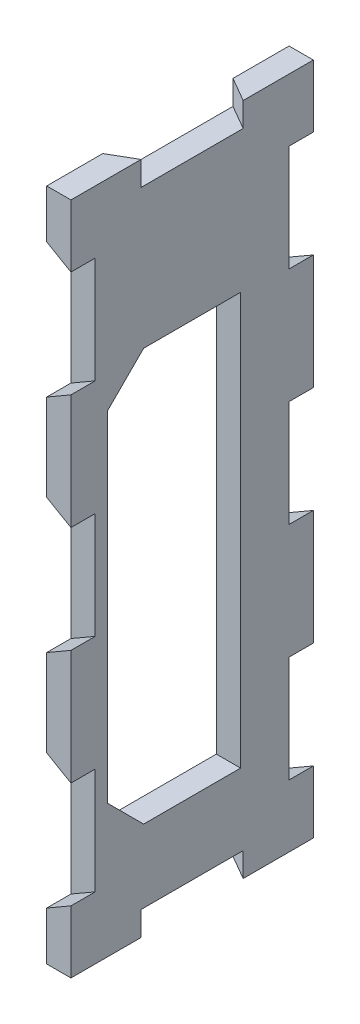
from build123d import *

# Parameters (mm, degrees)
SKETCH2_W           = 139
SKETCH2_H           = 50
BOSS_EXTRUDE1_DEPTH = 5
CUT_EXTRUDE1_DEPTH  = 5
CUT_EXTRUDE2_START  = -45
CUT_EXTRUDE2_DEPTH  = 5
CUT_EXTRUDE3_DEPTH  = 5
CUT_EXTRUDE5_START  = -134
CUT_EXTRUDE5_DEPTH  = 5
CUT_EXTRUDE6_DEPTH  = 5


with BuildPart() as part:
    # Sketch2 → Boss-Extrude1 (new body)
    with BuildSketch(Plane.YZ):
        Rectangle(SKETCH2_W, SKETCH2_H)
    extrude(amount=BOSS_EXTRUDE1_DEPTH)

    # Sketch3 → Cut-Extrude1 (cut)
    with BuildSketch(Plane(origin=(0, 0, -25), x_dir=(1, 0, 0), z_dir=(0, 0, -1))):
        Polygon((0, 31.787187079), (0, 59.5), (24, 45.643593539), align=None)
        Polygon((0, -13.856406461), (0, 13.856406461), (24, 0), align=None)
        Polygon((0, -59.5), (0, -31.787187079), (24, -45.643593539), align=None)
    extrude(amount=-CUT_EXTRUDE1_DEPTH, mode=Mode.SUBTRACT)

    # Sketch3<3> → Cut-Extrude2 (cut)
    with BuildSketch(Plane(origin=(0, 0, -25), x_dir=(1, 0, 0), z_dir=(0, 0, -1)).offset(CUT_EXTRUDE2_START)):
        Polygon((0, 31.787187079), (0, 59.5), (24, 45.643593539), align=None)
        Polygon((0, -13.856406461), (0, 13.856406461), (24, 0), align=None)
        Polygon((0, -59.5), (0, -31.787187079), (24, -45.643593539), align=None)
    extrude(amount=-CUT_EXTRUDE2_DEPTH, mode=Mode.SUBTRACT)

    # Sketch6 → Cut-Extrude3 (cut)
    with BuildSketch(Plane(origin=(0, 69.5, 0), x_dir=(-1, 0, 0), z_dir=(0, 1, 0))):
        Polygon((0, 13.423393759), (0, -13.423393759), (-23.25, 0), align=None)
    extrude(amount=-CUT_EXTRUDE3_DEPTH, mode=Mode.SUBTRACT)

    # Sketch6<3> → Cut-Extrude5 (cut)
    with BuildSketch(Plane(origin=(0, 69.5, 0), x_dir=(-1, 0, 0), z_dir=(0, 1, 0)).offset(CUT_EXTRUDE5_START)):
        Polygon((0, 13.423393759), (0, -13.423393759), (-23.25, 0), align=None)
    extrude(amount=-CUT_EXTRUDE5_DEPTH, mode=Mode.SUBTRACT)

    # Sketch4 → Cut-Extrude6 (cut)
    with BuildSketch(Plane(origin=(0, 0, 0), x_dir=(0, -1, 0), z_dir=(-1, 0, 0))):
        Polygon((-35.5, -10), (49.5, -10), (49.5, 10), (42, 17.5), (-28, 17.5), (-35.5, 10), align=None)
    extrude(amount=-CUT_EXTRUDE6_DEPTH, mode=Mode.SUBTRACT)


solid = part.part
